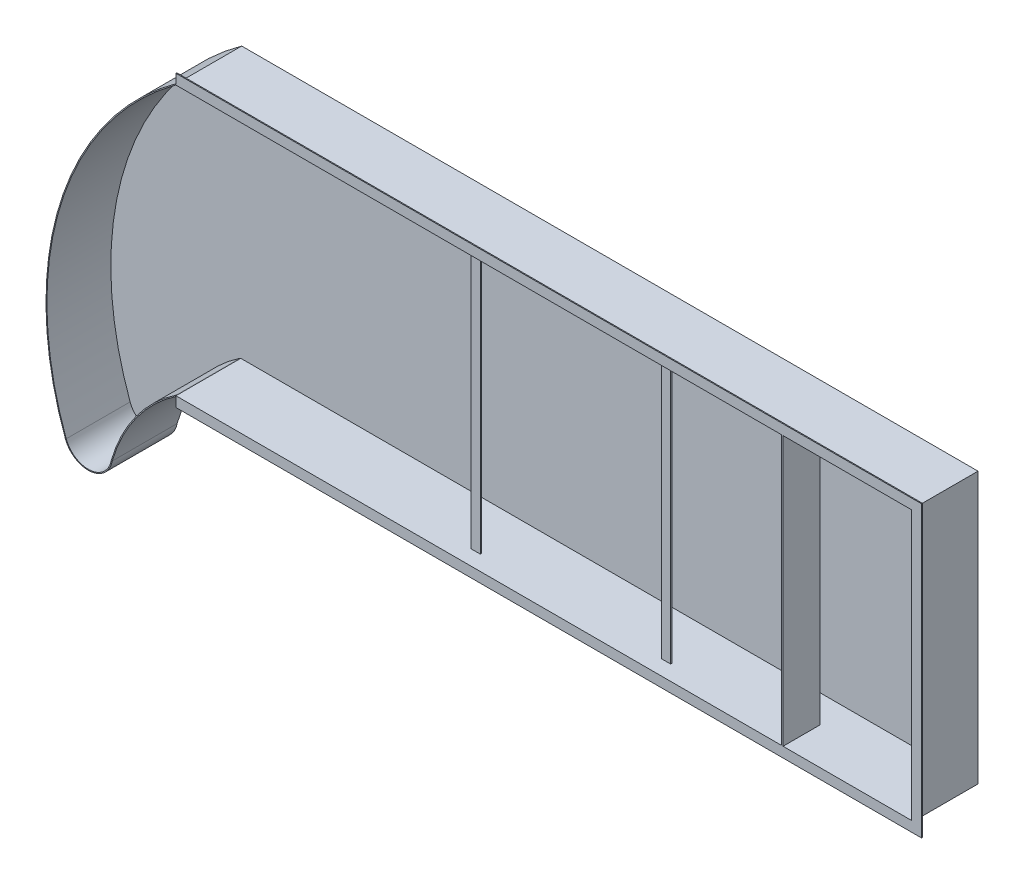
from build123d import *

# Parameters (mm, degrees)
SKETCH_1_W          = 1590
SKETCH_1_H          = 585
EXTRUDE_1_DEPTH     = 2
EXTRUDE_2_DEPTH     = 140
SKETCH_3_W          = 1590
SKETCH_3_H          = 2
EXTRUDE_3_DEPTH     = 20
EXTRUDE_4_DEPTH     = 20
EXTRUDE_5_DEPTH     = 140
CUT_EXTRUDE_1_DEPTH = 138
SKETCH_8_W          = 20
SKETCH_8_H          = 3
EXTRUDE_6_DEPTH     = 581
SKETCH_9_W          = 3
SKETCH_9_H          = 80
EXTRUDE_7_DEPTH     = 581


with BuildPart() as part:
    # 草图1 → 凸台-拉伸1 (new body)
    with BuildSketch(Plane.XY):
        Rectangle(SKETCH_1_W, SKETCH_1_H)
    extrude(amount=EXTRUDE_1_DEPTH)

    # 草图2 → 凸台-拉伸2 (add)
    with BuildSketch(Plane.XY.offset(2)):
        Polygon((-795, -290.5), (793, -290.5), (793, 290.5), (-795, 290.5), (-795, 292.5), (795, 292.5), (795, -292.5), (-795, -292.5), align=None)
    extrude(amount=EXTRUDE_2_DEPTH)

    # 草图3 → 凸台-拉伸3 (add)
    with BuildSketch(Plane.XZ.offset(292.5)):
        with Locations((0, 141)):
            Rectangle(SKETCH_3_W, SKETCH_3_H)
    extrude_3 = extrude(amount=EXTRUDE_3_DEPTH)

    # 镜向1: 凸台-拉伸3 across plane
    add(extrude_3.mirror(Plane.ZX))

    # 草图4 → 凸台-拉伸4 (add)
    with BuildSketch(Plane(origin=(795, 0, 0), x_dir=(0, 0, -1), z_dir=(1, 0, 0))):
        Polygon((-140, 292.5), (-140, -292.5), (-140, -312.5), (-142, -312.5), (-142, 312.5), (-140, 312.5), align=None)
    extrude(amount=EXTRUDE_4_DEPTH)

    # 草图5 → 凸台-拉伸5 (add)
    with BuildSketch(Plane(origin=(0, 0, 0), x_dir=(-1, 0, 0), z_dir=(0, 0, -1))):
        with BuildLine():
            Line((795, 292.5), (795, -292.5))
            ThreePointArc((795, -292.5), (881.764191445, -375.573491887), (934.56290386, -483.469395139))
            ThreePointArc((934.56290386, -483.469395139), (981.860032363, -526.426096766), (1035.791420617, -492.166763143))
            ThreePointArc((1035.791420617, -492.166763143), (1047.805683522, -59.200609736), (795, 292.5))
        make_face()
    extrude(amount=-EXTRUDE_5_DEPTH)

    # 草图6 → 切除-拉伸1 (cut)
    with BuildSketch(Plane.XY.offset(140)):
        with BuildLine():
            Line((-797, -291.43118398), (-795, -290.5))
            Line((-795, -290.5), (-795, 290.5))
            Line((-795, 290.5), (-797, 288.591040402))
            ThreePointArc((-797, 288.591040402), (-1046.463523913, -61.653894645), (-1033.91490125, -491.474899668))
            ThreePointArc((-1033.91490125, -491.474899668), (-981.983290729, -524.429295604), (-936.512623715, -483.013081096))
            ThreePointArc((-936.512623715, -483.013081096), (-883.723814588, -374.866159142), (-797, -291.43118398))
        make_face()
    extrude(amount=-CUT_EXTRUDE_1_DEPTH, mode=Mode.SUBTRACT)

    # 草图8 → 凸台-拉伸6 (add)
    with BuildSketch(Plane.XZ.offset(-290.5)):
        with Locations((-180.065727279, 108.071414122)):
            Rectangle(SKETCH_8_W, SKETCH_8_H)
        with Locations((230.676945024, 108.071414122)):
            Rectangle(SKETCH_8_W, SKETCH_8_H)
    extrude(amount=EXTRUDE_6_DEPTH)

    # 草图9 → 凸台-拉伸7 (add)
    with BuildSketch(Plane.XZ.offset(-290.5)):
        with Locations((514.5, 102)):
            Rectangle(SKETCH_9_W, SKETCH_9_H)
    extrude(amount=EXTRUDE_7_DEPTH)


solid = part.part
